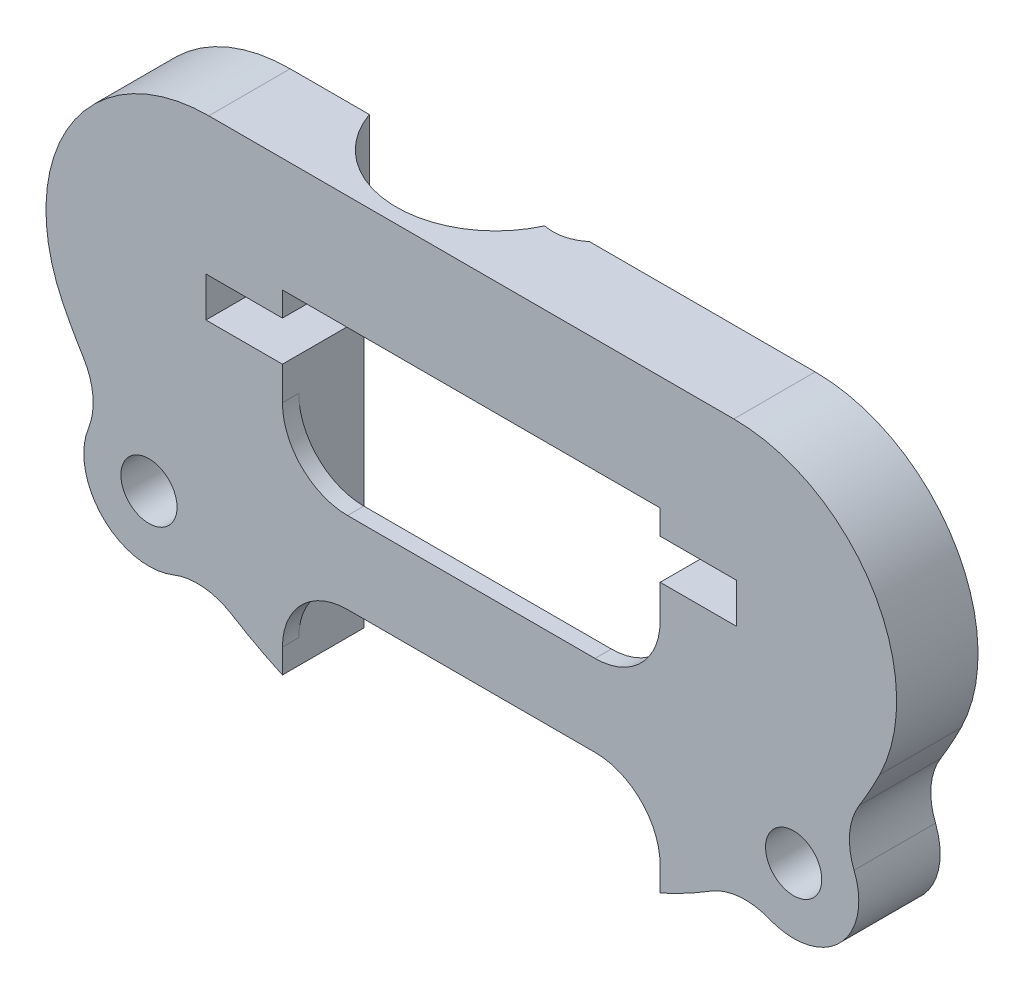
from build123d import *

# Parameters (mm, degrees)
SKETCH1_R           = 1.725
BOSS_EXTRUDE1_DEPTH = 5
CUT_EXTRUDE3_REACH  = 41.552
SKETCH6_W           = 23.2
SKETCH6_H           = 5
BOSS_EXTRUDE2_DEPTH = 1
CUT_EXTRUDE4_DEPTH  = 2
FILLET1_R           = 4
FILLET2_R           = 10


with BuildPart() as part:
    # Sketch1 → Boss-Extrude1 (new body)
    with BuildSketch(Plane.XY):
        with BuildLine():
            Line((-27.928480088, 2), (27.928480088, 2))
            ThreePointArc((27.928480088, 2), (26.866863434, -7.884900077), (22.418161887, -16.775756842))
            ThreePointArc((22.418161887, -16.775756842), (22.627416998, -22.627416998), (16.775756842, -22.418161887))
            ThreePointArc((16.775756842, -22.418161887), (14.270455763, -24.090539478), (11.6, -25.484112698))
            Line((11.6, -25.484112698), (11.6, -8.95))
            Line((11.6, -8.95), (16.3, -8.95))
            Line((16.3, -8.95), (16.3, -6.5))
            Line((16.3, -6.5), (11.6, -6.5))
            Line((11.6, -6.5), (11.6, -5))
            Line((11.6, -5), (-11.6, -5))
            Line((-11.6, -5), (-11.6, -6.5))
            Line((-11.6, -6.5), (-16.3, -6.5))
            Line((-16.3, -6.5), (-16.3, -8.95))
            Line((-16.3, -8.95), (-11.6, -8.95))
            Line((-11.6, -8.95), (-11.6, -25.484112698))
            ThreePointArc((-11.6, -25.484112698), (-14.270455763, -24.090539478), (-16.775756842, -22.418161887))
            ThreePointArc((-16.775756842, -22.418161887), (-22.627416998, -22.627416998), (-22.418161887, -16.775756842))
            ThreePointArc((-22.418161887, -16.775756842), (-26.866863434, -7.884900077), (-27.928480088, 2))
        make_face()
        with Locations((-19.798989873, -19.798989873)):
            Circle(SKETCH1_R, mode=Mode.SUBTRACT)
        with Locations((19.798989873, -19.798989873)):
            Circle(SKETCH1_R, mode=Mode.SUBTRACT)
    extrude(amount=BOSS_EXTRUDE1_DEPTH)

    # Sketch5 → Cut-Extrude3 (cut, up to next)
    with BuildSketch(Plane(origin=(0, 2, 0), x_dir=(1, 0, 0), z_dir=(0, 1, 0)), mode=Mode.PRIVATE) as cut_extrude3_sk1:
        with BuildLine():
            ThreePointArc((0.045901639, 4.540270656), (-11.6, 2), (0.045901639, -0.540270656))
            ThreePointArc((0.045901639, -0.540270656), (3.2, 2), (0.045901639, 4.540270656))
        make_face()
    cut_extrude3_tool1 = extrude(cut_extrude3_sk1.sketch, amount=-CUT_EXTRUDE3_REACH, mode=Mode.PRIVATE) & part.part
    add(cut_extrude3_tool1.solids().sort_by_distance((-4.860102, 2, -2))[0], mode=Mode.SUBTRACT)

    # Sketch6 → Boss-Extrude2 (add)
    with BuildSketch(Plane.XY.offset(5)):
        with Locations((0, -17.5)):
            Rectangle(SKETCH6_W, SKETCH6_H)
    extrude(amount=-BOSS_EXTRUDE2_DEPTH)

    # Sketch7 → Cut-Extrude4 (cut)
    with BuildSketch(Plane(origin=(0, 0, 0), x_dir=(-1, 0, 0), z_dir=(0, 0, -1))):
        Polygon((-16.698989873, -21.588775708), (-16.698989873, -18.009204039), (-19.798989873, -16.219418204), (-22.898989873, -18.009204039), (-22.898989873, -21.588775708), (-19.798989873, -23.378561542), align=None)
        Polygon((22.898989873, -18.009204039), (19.798989873, -16.219418204), (16.698989873, -18.009204039), (16.698989873, -21.588775708), (19.798989873, -23.378561542), (22.898989873, -21.588775708), align=None)
    extrude(amount=-CUT_EXTRUDE4_DEPTH, mode=Mode.SUBTRACT)

    # Fillet1
    fillet1_edges = [part.edges().sort_by_distance(p)[0] for p in [
        (-22.418161887, -16.775756842, 2.5),
        (-16.775756842, -22.418161887, 2.5),
        (22.418161887, -16.775756842, 2.5),
        (16.775756842, -22.418161887, 2.5),
        (-11.6, -20, 4.5),
        (-11.6, -15, 4.5),
        (11.6, -15, 4.5),
        (11.6, -20, 4.5),
    ]]
    fillet(fillet1_edges, radius=FILLET1_R)

    # Fillet2
    fillet2_edges = [part.edges().sort_by_distance(p)[0] for p in [
        (-27.928480088, 2, 2.5),
        (27.928480088, 2, 2.5),
    ]]
    fillet(fillet2_edges, radius=FILLET2_R)


solid = part.part
